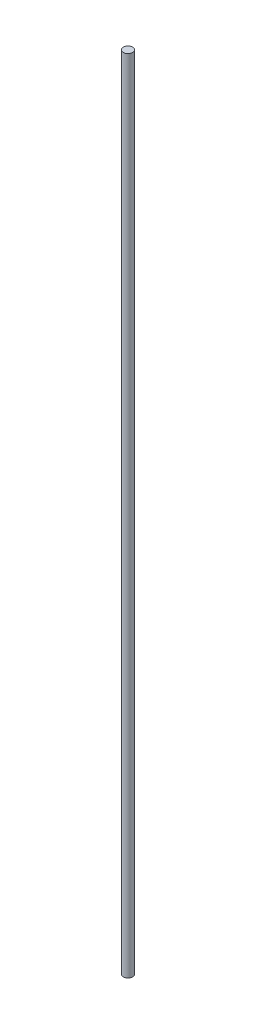
from build123d import *

# Parameters (mm, degrees)
SKETCH1_R           = 2.5
BOSS_EXTRUDE1_DEPTH = 215


with BuildPart() as part:
    # Sketch1 → Boss-Extrude1 (new, symmetric)
    with BuildSketch(Plane(origin=(0, 0, 0), x_dir=(1, 0, 0), z_dir=(0, 1, 0))):
        with Locations(Location((0, 0, 0), (0, 0, 270))):
            Circle(SKETCH1_R)
    extrude(amount=BOSS_EXTRUDE1_DEPTH, both=True)


solid = part.part
